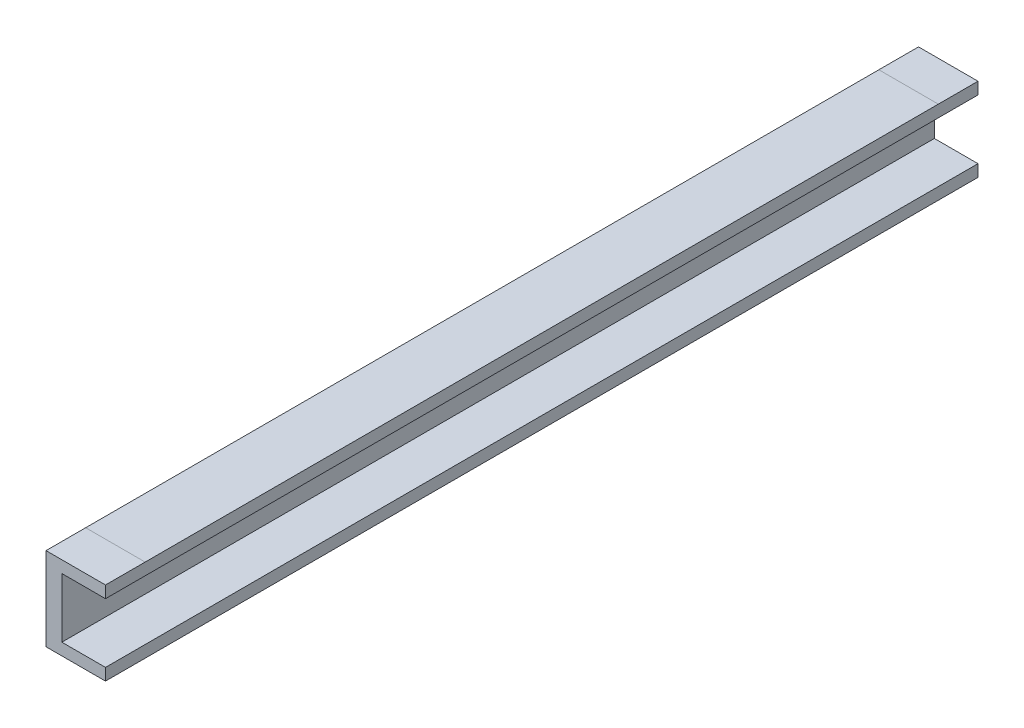
from build123d import *

# Parameters (mm, degrees)
DODANIE_WYCI_GNI_CIE1_DEPTH = 2200


with BuildPart() as part:
    # Szkic1 → Dodanie-wyciągnięcie1 (new body)
    with BuildSketch(Plane.XY):
        Polygon((0, 0), (0, 210), (150, 210), (150, 180), (40, 180), (40, 30), (150, 30), (150, 0), align=None)
    extrude(amount=DODANIE_WYCI_GNI_CIE1_DEPTH)


solid = part.part
